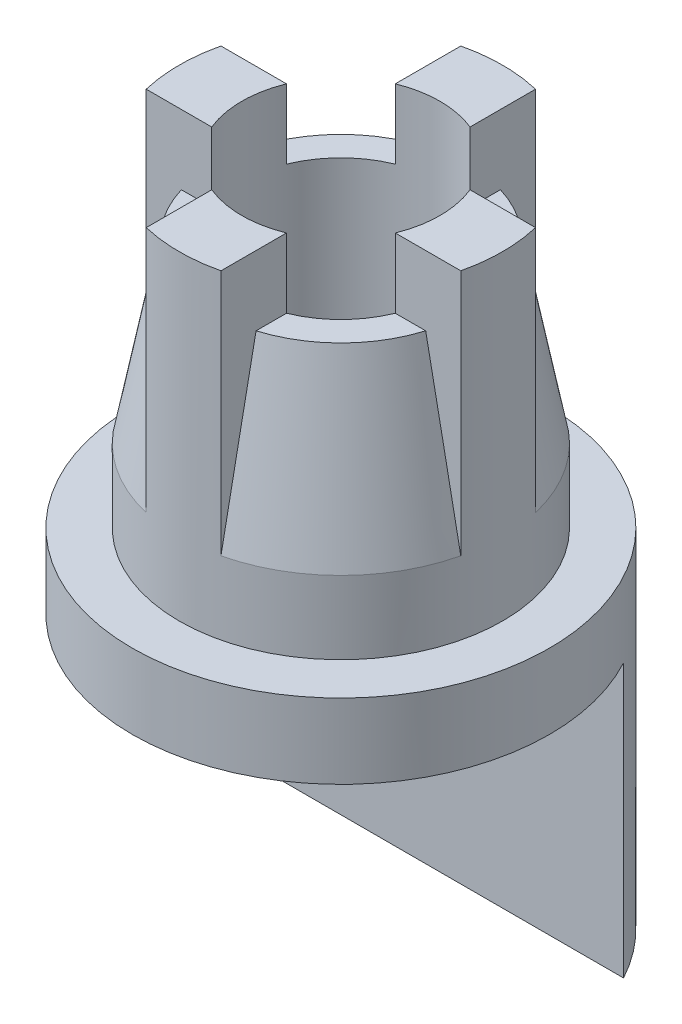
from build123d import *

# Parameters (mm, degrees)
CROQUIS1_R                 = 6
SALIENTE_EXTRUIR1_DEPTH    = 2.15
CROQUIS4_R                 = 4.65
SALIENTE_EXTRUIR3_DEPTH    = 7.2
CORTAR_EXTRUIR1_DEPTH      = 7.2
CORTAR_EXTRUIR1_DEPTH_BACK = 12.128342
CROQUIS2_R                 = 2.85
SALIENTE_EXTRUIR2_START    = -10
SALIENTE_EXTRUIR2_DEPTH    = 10
CHAFL_N1_SIZE              = 5.1
CHAFL_N1_SIZE2             = 0.975
SALIENTE_EXTRUIR4_DEPTH    = 9.2


with BuildPart() as part:
    # Croquis1 → Saliente-Extruir1 (new body)
    with BuildSketch(Plane(origin=(0, 0, 0), x_dir=(1, 0, 0), z_dir=(0, 1, 0))):
        Circle(CROQUIS1_R)
    extrude(amount=SALIENTE_EXTRUIR1_DEPTH)

    # Croquis4 → Saliente-Extruir3 (add)
    with BuildSketch(Plane(origin=(0, 2.15, 0), x_dir=(1, 0, 0), z_dir=(0, 1, 0))):
        Circle(CROQUIS4_R)
    extrude(amount=SALIENTE_EXTRUIR3_DEPTH)

    # Croquis2 → Cortar-Extruir1 (cut, two sides: drawn at the far end of the back side and taken through both)
    with BuildSketch(Plane(origin=(0, 2.15, 0), x_dir=(1, 0, 0), z_dir=(0, 1, 0)).offset(-CORTAR_EXTRUIR1_DEPTH_BACK)):
        Circle(CROQUIS2_R)
    extrude(amount=CORTAR_EXTRUIR1_DEPTH + CORTAR_EXTRUIR1_DEPTH_BACK, mode=Mode.SUBTRACT)

    # Croquis3 → Saliente-Extruir2 (add)
    with BuildSketch(Plane(origin=(0, 2.15, 0), x_dir=(1, 0, 0), z_dir=(0, 1, 0)).offset(SALIENTE_EXTRUIR2_START)):
        with BuildLine():
            Line((-5.279915, 2.85), (5.279915, 2.85))
            ThreePointArc((5.279915, 2.85), (0, 6), (-5.279915, 2.85))
        make_face()
    extrude(amount=SALIENTE_EXTRUIR2_DEPTH)

    # Chaflán1
    chafl_n1_edges = [part.edges().sort_by_distance(p)[0] for p in [
        (-4.65, 9.35, 0),
    ]]
    chafl_n1_side = [part.faces().sort_by_distance(p)[0] for p in [
        (-4.65, 5.75, 0),
    ]]
    chamfer(chafl_n1_edges, length=CHAFL_N1_SIZE, length2=CHAFL_N1_SIZE2, reference=chafl_n1_side[0])

    # Croquis6 → Saliente-Extruir4 (add)
    with BuildSketch(Plane(origin=(0, 2.15, 0), x_dir=(1, 0, 0), z_dir=(0, 1, 0))):
        with BuildLine():
            Line((-4.524033, -1.075), (-2.639484, -1.075))
            ThreePointArc((-2.639484, -1.075), (-2.85, 0), (-2.639484, 1.075))
            Line((-2.639484, 1.075), (-4.524033, 1.075))
            ThreePointArc((-4.524033, 1.075), (-4.65, 0), (-4.524033, -1.075))
        make_face()
        with BuildLine():
            Line((1.075, -4.524033), (1.075, -2.639484))
            ThreePointArc((1.075, -2.639484), (0, -2.85), (-1.075, -2.639484))
            Line((-1.075, -2.639484), (-1.075, -4.524033))
            ThreePointArc((-1.075, -4.524033), (0, -4.65), (1.075, -4.524033))
        make_face()
        with BuildLine():
            Line((2.639484, 1.075), (4.524033, 1.075))
            ThreePointArc((4.524033, 1.075), (4.65, 0), (4.524033, -1.075))
            Line((4.524033, -1.075), (2.639484, -1.075))
            ThreePointArc((2.639484, -1.075), (2.85, 0), (2.639484, 1.075))
        make_face()
        with BuildLine():
            Line((-1.075, 2.639484), (-1.075, 4.524033))
            ThreePointArc((-1.075, 4.524033), (0, 4.65), (1.075, 4.524033))
            Line((1.075, 4.524033), (1.075, 2.639484))
            ThreePointArc((1.075, 2.639484), (0, 2.85), (-1.075, 2.639484))
        make_face()
    extrude(amount=SALIENTE_EXTRUIR4_DEPTH)


solid = part.part
